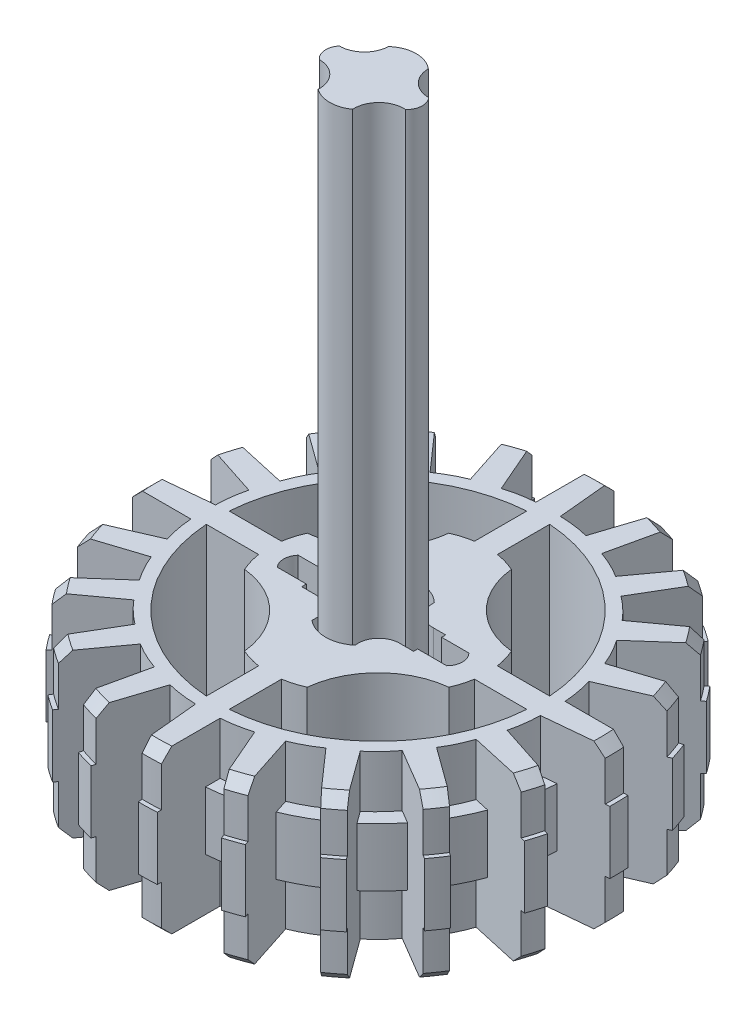
from build123d import *

# Parameters (mm, degrees)
CUT_EXTRUDE1_DEPTH  = 10
CIRPATTERN1_COUNT   = 20
SKETCH3_W           = 1.3
SKETCH3_H           = 2.8
BOSS_EXTRUDE1_DEPTH = 3.9
CUT_EXTRUDE3_DEPTH  = 7.8
BOSS_EXTRUDE2_DEPTH = 26


with BuildPart() as part:
    # Sketch1 → Revolve2 (revolve)
    with BuildSketch(Plane(origin=(0, 0, 0), x_dir=(0, 0, -1), z_dir=(1, 0, 0)), mode=Mode.PRIVATE) as revolve2_sk:
        Polygon((0, 3.9), (0, -3.9), (2.905415037, -3.9), (3.4, -3.405415037), (3.4, -1.5), (3.6, -1.5), (3.6, 1.5), (3.4, 1.5), (3.4, 3.405415037), (2.905415037, 3.9), align=None)
    revolve(revolve2_sk.sketch.rotate(Axis((0, 5.613307724, 7.7), (0, -1, 0)), 180), axis=Axis((0, 5.613307724, 7.7), (0, -1, 0)))

    # Sketch2 → Cut-Extrude1 (cut)
    with BuildSketch(Plane(origin=(0, 3.9, 0), x_dir=(1, 0, 0), z_dir=(0, 1, 0))):
        with BuildLine():
            Line((0.7, -15.968115805), (0.7, -19.968115805))
            ThreePointArc((0.7, -19.968115805), (2.218424713, -19.782103667), (3.7, -19.401119687))
            Line((3.7, -19.401119687), (2.1, -15.708103671))
            ThreePointArc((2.1, -15.708103671), (1.407462969, -15.878293079), (0.7, -15.968115805))
        make_face()
    cut_extrude1 = extrude(amount=-CUT_EXTRUDE1_DEPTH, mode=Mode.SUBTRACT)

    # CirPattern1: Cut-Extrude1 ×20 about axis
    cirpattern1_axis = Axis((0, 0, 7.7), (0, 1, 0))
    for i in range(1, CIRPATTERN1_COUNT):
        add(cut_extrude1.rotate(cirpattern1_axis, i * 360 / CIRPATTERN1_COUNT), mode=Mode.SUBTRACT)

    # Sketch3 → Revolve3 (revolve)
    with BuildSketch(Plane(origin=(0, 0, 0), x_dir=(0, 0, -1), z_dir=(1, 0, 0))):
        with Locations((0.65, 0)):
            Rectangle(SKETCH3_W, SKETCH3_H)
    revolve(axis=Axis((0, 4.919519936, 7.7), (0, -1, 0)))

    # Sketch4 → Boss-Extrude1 (add, symmetric)
    with BuildSketch(Plane(origin=(0, 0, 0), x_dir=(1, 0, 0), z_dir=(0, 1, 0))):
        with BuildLine():
            ThreePointArc((-0.55, -0.019667976), (0, 0), (0.55, -0.019667976))
            Line((0.55, -0.019667976), (0.55, -2.526904024))
            ThreePointArc((0.55, -2.526904024), (1.034448132, -2.634222767), (1.5, -2.80588745))
            ThreePointArc((1.5, -2.80588745), (2.595809493, -5.104190507), (4.89411255, -6.2))
            ThreePointArc((4.89411255, -6.2), (5.065777233, -6.665551868), (5.173095976, -7.15))
            Line((5.173095976, -7.15), (7.680332024, -7.15))
            ThreePointArc((7.680332024, -7.15), (7.7, -7.7), (7.680332024, -8.25))
            Line((7.680332024, -8.25), (5.173095976, -8.25))
            ThreePointArc((5.173095976, -8.25), (5.065777233, -8.734448132), (4.89411255, -9.2))
            ThreePointArc((4.89411255, -9.2), (2.595809493, -10.295809493), (1.5, -12.59411255))
            ThreePointArc((1.5, -12.59411255), (1.034448132, -12.765777233), (0.55, -12.873095976))
            Line((0.55, -12.873095976), (0.55, -15.380332024))
            ThreePointArc((0.55, -15.380332024), (0, -15.4), (-0.55, -15.380332024))
            Line((-0.55, -15.380332024), (-0.55, -12.873095976))
            ThreePointArc((-0.55, -12.873095976), (-1.034448132, -12.765777233), (-1.5, -12.59411255))
            ThreePointArc((-1.5, -12.59411255), (-2.595809493, -10.295809493), (-4.89411255, -9.2))
            ThreePointArc((-4.89411255, -9.2), (-5.065777233, -8.734448132), (-5.173095976, -8.25))
            Line((-5.173095976, -8.25), (-7.680332024, -8.25))
            ThreePointArc((-7.680332024, -8.25), (-7.7, -7.7), (-7.680332024, -7.15))
            Line((-7.680332024, -7.15), (-5.173095976, -7.15))
            ThreePointArc((-5.173095976, -7.15), (-5.065777233, -6.665551868), (-4.89411255, -6.2))
            ThreePointArc((-4.89411255, -6.2), (-2.595809493, -5.104190507), (-1.5, -2.80588745))
            ThreePointArc((-1.5, -2.80588745), (-1.034448132, -2.634222767), (-0.55, -2.526904024))
            Line((-0.55, -2.526904024), (-0.55, -0.019667976))
        make_face()
    extrude(amount=BOSS_EXTRUDE1_DEPTH, both=True)

    # Sketch6 → Cut-Extrude3 (cut)
    with BuildSketch(Plane(origin=(0, 3.9, 0), x_dir=(1, 0, 0), z_dir=(0, 1, 0))):
        with BuildLine():
            Line((-4.196398437, -7.329357702), (-2.892459942, -7.329357702))
            Line((-2.892459942, -7.329357702), (-2.892459942, -7.105958389))
            Line((-2.892459942, -7.105958389), (-2.301341157, -7.105958389))
            ThreePointArc((-2.301341157, -7.105958389), (-1.544370232, -6.820727767), (-1.247342536, -6.068307646))
            ThreePointArc((-1.247342536, -6.068307646), (-0.112426717, -5.579375902), (1.035905927, -6.035906628))
            ThreePointArc((1.035905927, -6.035906628), (1.310448144, -6.79704277), (2.058847205, -7.104614715))
            Line((2.058847205, -7.104614715), (2.649965989, -7.104614715))
            Line((2.649965989, -7.104614715), (2.649965989, -7.299089381))
            Line((2.649965989, -7.299089381), (3.954541033, -7.299089381))
            ThreePointArc((3.954541033, -7.299089381), (4.174185363, -7.829357702), (3.954541033, -8.359626024))
            Line((3.954541033, -8.359626024), (2.561728319, -8.359626024))
            Line((2.561728319, -8.359626024), (2.561728319, -8.55410069))
            Line((2.561728319, -8.55410069), (1.970609534, -8.55410069))
            ThreePointArc((1.970609534, -8.55410069), (1.161100311, -8.870816011), (0.906894963, -9.702076151))
            ThreePointArc((0.906894963, -9.702076151), (-0.130526357, -10.079339502), (-1.167947678, -9.702076151))
            ThreePointArc((-1.167947678, -9.702076151), (-1.415434267, -8.878139792), (-2.211830389, -8.552757015))
            Line((-2.211830389, -8.552757015), (-2.802949174, -8.552757015))
            Line((-2.802949174, -8.552757015), (-2.802949174, -8.329357702))
            Line((-2.802949174, -8.329357702), (-4.196398437, -8.329357702))
            ThreePointArc((-4.196398437, -8.329357702), (-4.38741129, -7.829357702), (-4.196398437, -7.329357702))
        make_face()
    extrude(amount=-CUT_EXTRUDE3_DEPTH, mode=Mode.SUBTRACT)


with BuildPart() as body_2:
    # Sketch7 → Boss-Extrude2 (new body)
    with BuildSketch(Plane(origin=(0, 0, 0), x_dir=(1, 0, 0), z_dir=(0, 1, 0))):
        with BuildLine():
            ThreePointArc((2.032213828, -7.304989374), (2.222394692, -7.840769061), (1.978019421, -8.35410069))
            ThreePointArc((1.978019421, -8.35410069), (1.053759687, -8.694360423), (0.696780592, -9.612292156))
            ThreePointArc((0.696780592, -9.612292156), (-0.130525826, -9.879341135), (-0.957833299, -9.612295426))
            ThreePointArc((-0.957833299, -9.612295426), (-1.286126334, -8.723511995), (-2.157346347, -8.351103623))
            ThreePointArc((-2.157346347, -8.351103623), (-2.418590251, -7.848023979), (-2.24758656, -7.307565614))
            ThreePointArc((-2.24758656, -7.307565614), (-1.413881489, -6.972807612), (-1.047270864, -6.152610249))
            ThreePointArc((-1.047270864, -6.152610249), (-0.112785124, -5.779401639), (0.833470509, -6.121671331))
            ThreePointArc((0.833470509, -6.121671331), (1.189800654, -6.959540062), (2.032213828, -7.304989374))
        make_face()
    extrude(amount=BOSS_EXTRUDE2_DEPTH)


solid = Compound([part.part, body_2.part])
